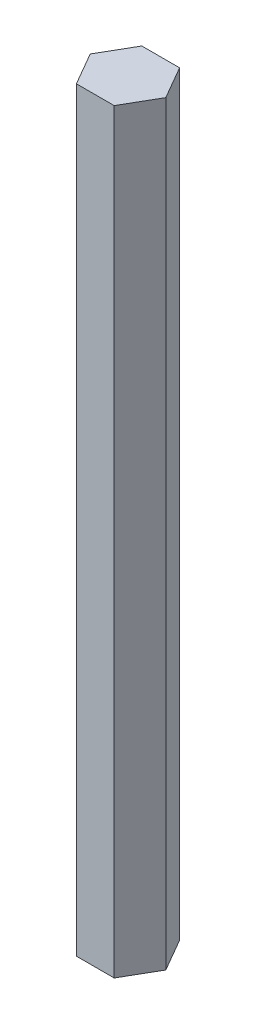
from build123d import *

# Parameters (mm, degrees)
BOSS_EXTRU_1_DEPTH = 60


with BuildPart() as part:
    # Esquisse3 → Boss.-Extru.1 (new body)
    with BuildSketch(Plane(origin=(0, 0, 0), x_dir=(1, 0, 0), z_dir=(0, 1, 0))):
        Polygon((3, 0), (1.5, 2.598076211), (-1.5, 2.598076211), (-3, 0), (-1.5, -2.598076211), (1.5, -2.598076211), align=None)
    extrude(amount=BOSS_EXTRU_1_DEPTH)


solid = part.part
